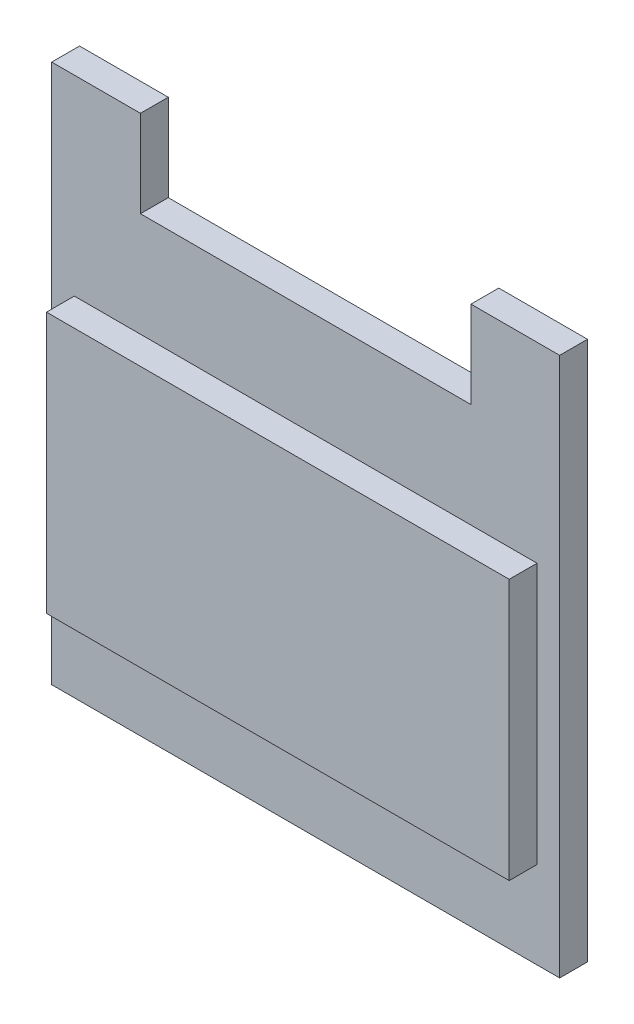
from build123d import *

# Parameters (mm, degrees)
SKETCH_1_W      = 26.6
SKETCH_1_H      = 15
EXTRUDE_1_DEPTH = 1.6
SKETCH_1_3_W    = 26.6
SKETCH_1_3_H    = 15
EXTRUDE_2_DEPTH = 1.6
SKETCH_5_W      = 20
SKETCH_5_H      = 2
EXTRUDE_3_DEPTH = 4.1


with BuildPart() as part:
    # 草图1 → 凸台-拉伸1 (new, symmetric)
    with BuildSketch(Plane.XY):
        with Locations((0.674374762, -2.696596571)):
            Rectangle(SKETCH_1_W, SKETCH_1_H)
    extrude(amount=EXTRUDE_1_DEPTH, both=True)


with BuildPart() as body_2:
    # 草图1<3> → 凸台-拉伸2 (new body)
    with BuildSketch(Plane.XY):
        Polygon((-8.825625238, 15.803403429), (-13.925625238, 15.803403429), (-13.925625238, -15.196596571), (15.274374762, -15.196596571), (15.274374762, 15.803403429), (10.174374762, 15.803403429), (10.174374762, 10.803403429), (-8.825625238, 10.803403429), align=None)
        with Locations((0.674374762, -2.696596571)):
            Rectangle(SKETCH_1_3_W, SKETCH_1_3_H, mode=Mode.SUBTRACT)
    extrude(amount=-EXTRUDE_2_DEPTH)

    # 草图5 → 凸台-拉伸3 (add)
    with BuildSketch(Plane.XY):
        with Locations((0.674374762, -13.014499015)):
            Rectangle(SKETCH_5_W, SKETCH_5_H)
    extrude(amount=-EXTRUDE_3_DEPTH)


solid = Compound([part.part, body_2.part])
